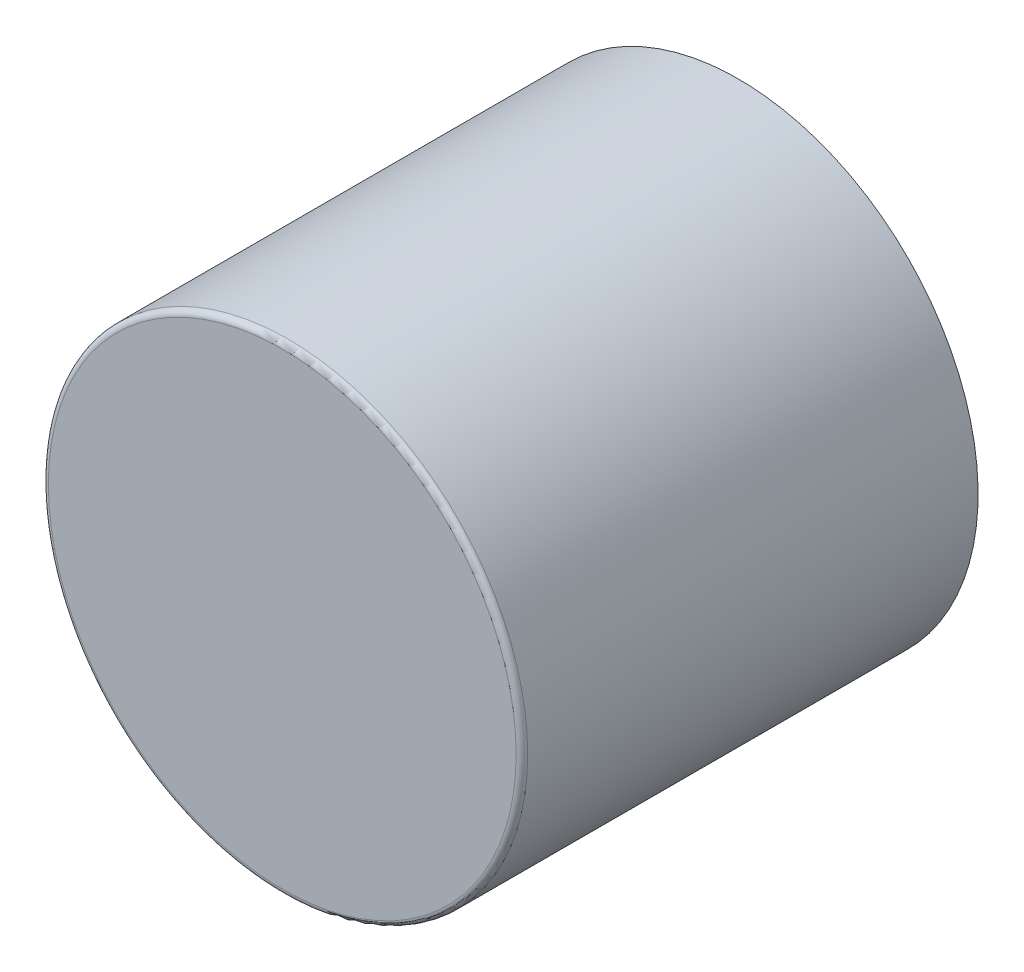
from build123d import *

# Parameters (mm, degrees)
ESQUISSE1_R             = 41.5
BOSS_EXTRU_1_DEPTH      = 1.5
BOSS_EXTRU_2_START      = 77.5
ESQUISSE2_R             = 41.5
ESQUISSE2_R_2           = 40
BOSS_EXTRU_2_DEPTH      = 77.5
ENL_V_MAT_EXTRU_2_DEPTH = 3
ENL_V_MAT_EXTRU_3_DEPTH = 15
FILLET1_R               = 1


with BuildPart() as part:
    # Esquisse1 → Boss.-Extru.1 (new body)
    with BuildSketch(Plane.XY):
        with Locations((11.097015348, 40.132293596)):
            Circle(ESQUISSE1_R)
    extrude(amount=BOSS_EXTRU_1_DEPTH)

    # Esquisse2 → Boss.-Extru.2 (add)
    with BuildSketch(Plane(origin=(0, 0, 0), x_dir=(-1, 0, 0), z_dir=(0, 0, -1)).offset(BOSS_EXTRU_2_START)):
        with Locations((-11.097015348, 40.132293596)):
            Circle(ESQUISSE2_R)
        with Locations((-11.097015348, 40.132293596)):
            Circle(ESQUISSE2_R_2, mode=Mode.SUBTRACT)
    extrude(amount=-BOSS_EXTRU_2_DEPTH)

    # Esquisse4 → Enlèv. mat.-Extru.2 (cut)
    with BuildSketch(Plane(origin=(0, 0, -77.5), x_dir=(-1, 0, 0), z_dir=(0, 0, -1))):
        with BuildLine():
            Line((-21.096949989, -0.144887377), (-21.096949989, 1.402443259))
            ThreePointArc((-21.096949989, 1.402443259), (-20.410817154, 1.231739668), (-19.721774233, 1.073190507))
            ThreePointArc((-19.721774233, 1.073190507), (-11.224690221, 0.132497358), (-2.721774233, 1.018928409))
            ThreePointArc((-2.721774233, 1.018928409), (-1.907360872, 1.202224875), (-1.096949989, 1.40247701))
            Line((-1.096949989, 1.40247701), (-1.096949989, -0.144854923))
            ThreePointArc((-1.096949989, -0.144854923), (-1.907510299, -0.337485214), (-2.721774233, -0.513805064))
            ThreePointArc((-2.721774233, -0.513805064), (-11.224476459, -1.367510664), (-19.721774233, -0.461591832))
            ThreePointArc((-19.721774233, -0.461591832), (-20.410708368, -0.309085242), (-21.096949989, -0.144887377))
        make_face()
    extrude(amount=-ENL_V_MAT_EXTRU_2_DEPTH, mode=Mode.SUBTRACT)

    # Esquisse5 → Enlèv. mat.-Extru.3 (cut)
    with BuildSketch(Plane(origin=(0, 0, -74.5), x_dir=(-1, 0, 0), z_dir=(0, 0, -1))):
        with BuildLine():
            Line((-19.597015348, 1.045850934), (-19.597015348, -0.487898427))
            ThreePointArc((-19.597015348, -0.487898427), (-11.097015348, -1.367706404), (-2.597015348, -0.487898427))
            Line((-2.597015348, -0.487898427), (-2.597015348, 1.045850934))
            ThreePointArc((-2.597015348, 1.045850934), (-11.097015348, 0.132293596), (-19.597015348, 1.045850934))
        make_face()
    extrude(amount=-ENL_V_MAT_EXTRU_3_DEPTH, mode=Mode.SUBTRACT)

    # Fillet1
    fillet1_edges = [part.edges().sort_by_distance(p)[0] for p in [
        (-30.402984652, 40.132293596, 1.5),
        (51.097015348, 40.132293596, 0),
    ]]
    fillet(fillet1_edges, radius=FILLET1_R)


solid = part.part
